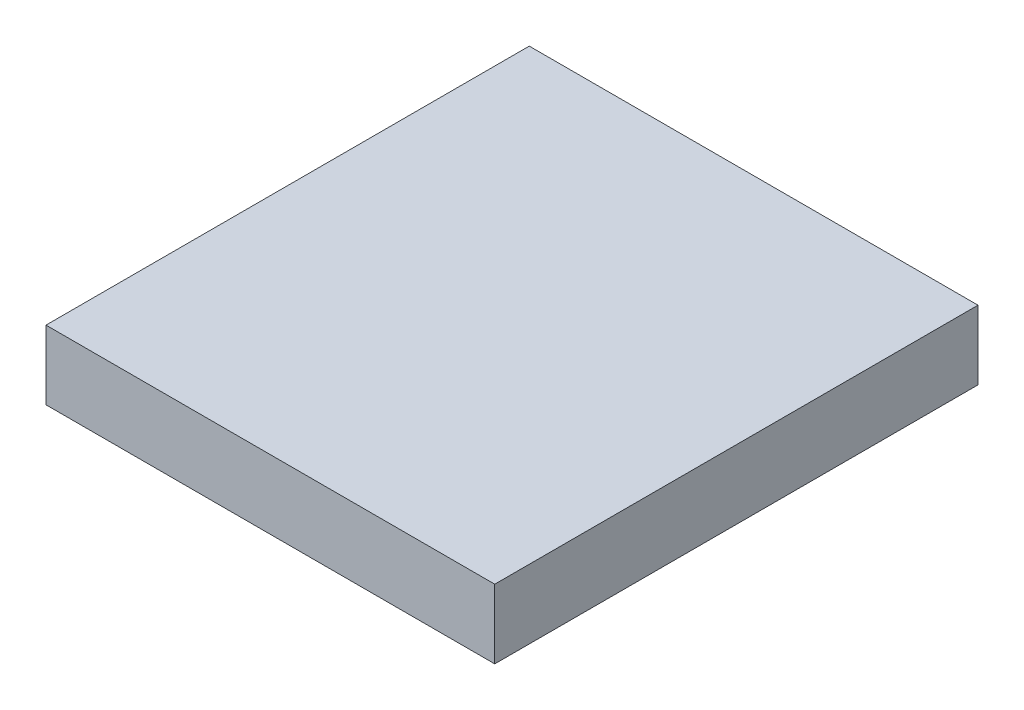
from build123d import *

# Parameters (mm, degrees)
SKETCH1_W           = 6.5
SKETCH1_H           = 7
BOSS_EXTRUDE1_DEPTH = 1


with BuildPart() as part:
    # Sketch1 → Boss-Extrude1 (new body)
    with BuildSketch(Plane(origin=(0, 0, 0), x_dir=(1, 0, 0), z_dir=(0, 1, 0))):
        with Locations((3.25, -3.5)):
            Rectangle(SKETCH1_W, SKETCH1_H)
    extrude(amount=BOSS_EXTRUDE1_DEPTH)


solid = part.part
